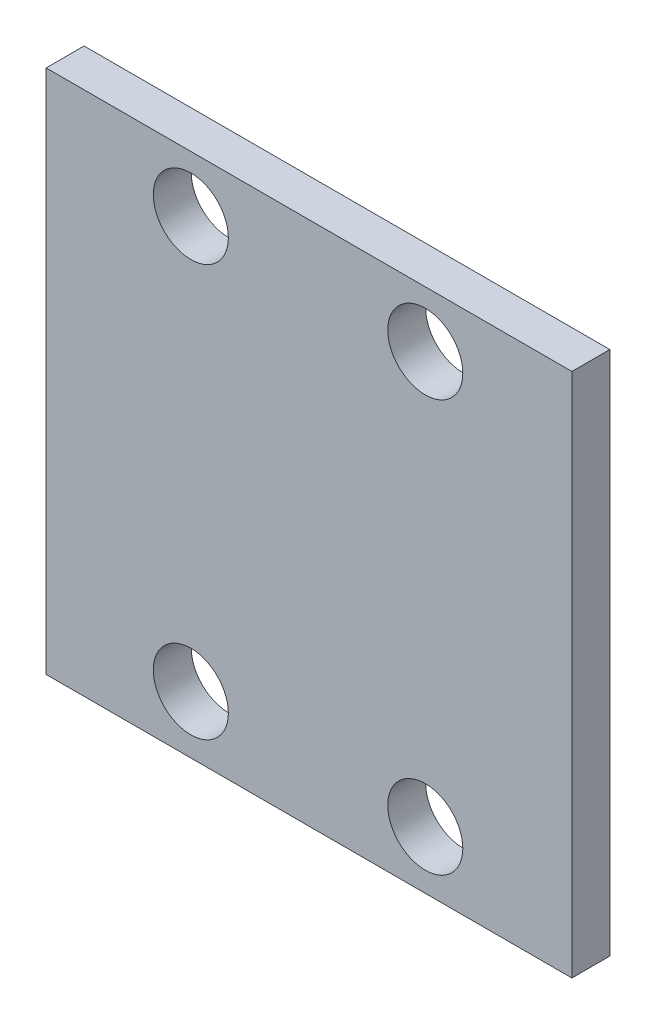
from build123d import *

# Parameters (mm, degrees)
SKETCH1_W             = 22.858863977
SKETCH1_H             = 22.839779742
BOSS_EXTRUDE1_DEPTH   = 0.825
F_4_CLEARANCE_HOLE1_D = 3.2639


with BuildPart() as part:
    # Sketch1 → Boss-Extrude1 (new, symmetric)
    with BuildSketch(Plane.XY):
        with Locations((11.429431989, 11.419889871)):
            Rectangle(SKETCH1_W, SKETCH1_H)
    extrude(amount=BOSS_EXTRUDE1_DEPTH, both=True)

    # #4 Clearance Hole1 (through all)
    with Locations(Plane.XY.offset(0.825)):
        with Locations((16.483506518, 20.400756331), (6.289658732, 20.400756331), (6.289658732, 2.503280726), (16.483506518, 2.503280726)):
            Hole(F_4_CLEARANCE_HOLE1_D / 2)


solid = part.part
